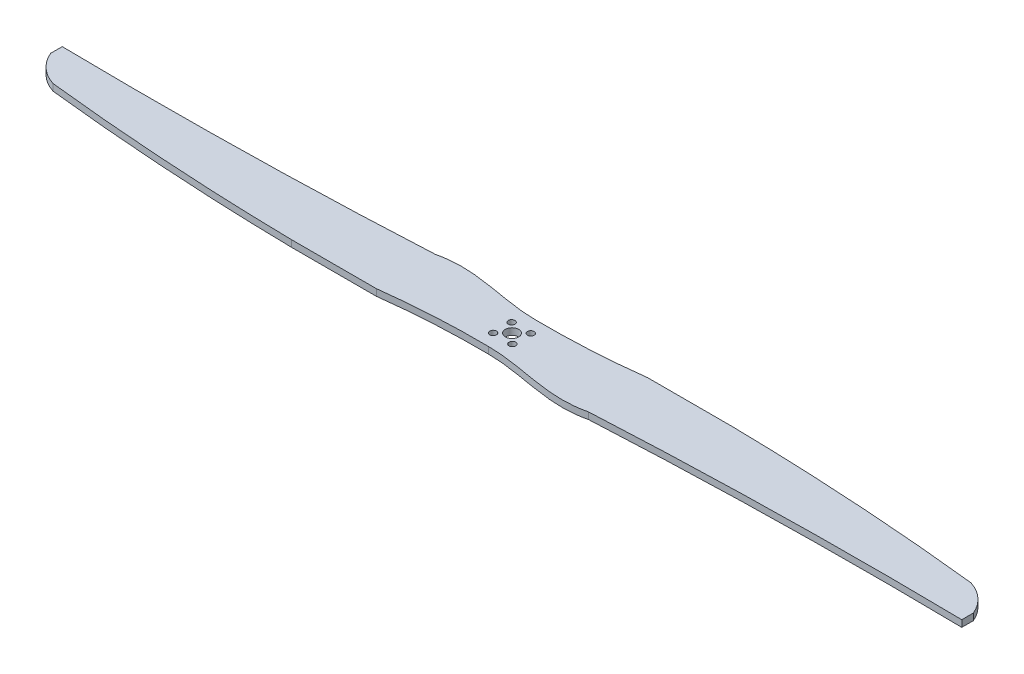
from build123d import *

# Parameters (mm, degrees)
SKETCH1_R           = 2.5
BOSS_EXTRUDE1_DEPTH = 2.5
CIRPATTERN1_COUNT   = 2


with BuildPart() as part:
    # Sketch1 → Boss-Extrude1 (new, symmetric)
    with BuildSketch(Plane(origin=(0, 0, 0), x_dir=(1, 0, 0), z_dir=(0, 1, 0))):
        with BuildLine():
            ThreePointArc((0, 5), (5, 0), (0, -5))
            Line((0, -5), (0, -17.5))
            add(Edge.make_bspline(
                [(0, -17.5), (26.944118738, -17.53258197), (52.619662803, -29.065950844), (80, -22.5)],
                knots=[0, 0, 0, 0, 1, 1, 1, 1], degree=3))
            ThreePointArc((80, -22.5), (217.756302371, -17.591386703), (355.6, -17.5))
            Line((355.6, -17.5), (355.6, -8.75))
            ThreePointArc((355.6, -8.75), (347.367245335, 2.896213541), (335, 10))
            add(Edge.make_bspline(
                [(335, 10), (239.516107029, 20.502209099), (143.75, 22)],
                knots=[0, 0, 0, 0.750368183, 0.750368183, 0.750368183], degree=2))
            Line((143.75, 22), (80, 22))
            ThreePointArc((80, 22), (40.077104301, 18.379256879), (0, 17.5))
            Line((0, 17.5), (0, 5))
        make_face()
        with Locations((7.209644007, 6.929721011)):
            Circle(SKETCH1_R, mode=Mode.SUBTRACT)
        with Locations((7.209644007, -6.929721011)):
            Circle(SKETCH1_R, mode=Mode.SUBTRACT)
    boss_extrude1 = extrude(amount=BOSS_EXTRUDE1_DEPTH, both=True)

    # CirPattern1: Boss-Extrude1 ×2 about axis
    cirpattern1_axis = Axis((0, -2.5, 0), (0, 1, 0))
    for i in range(1, CIRPATTERN1_COUNT):
        add(boss_extrude1.rotate(cirpattern1_axis, i * 360 / CIRPATTERN1_COUNT))


solid = part.part
